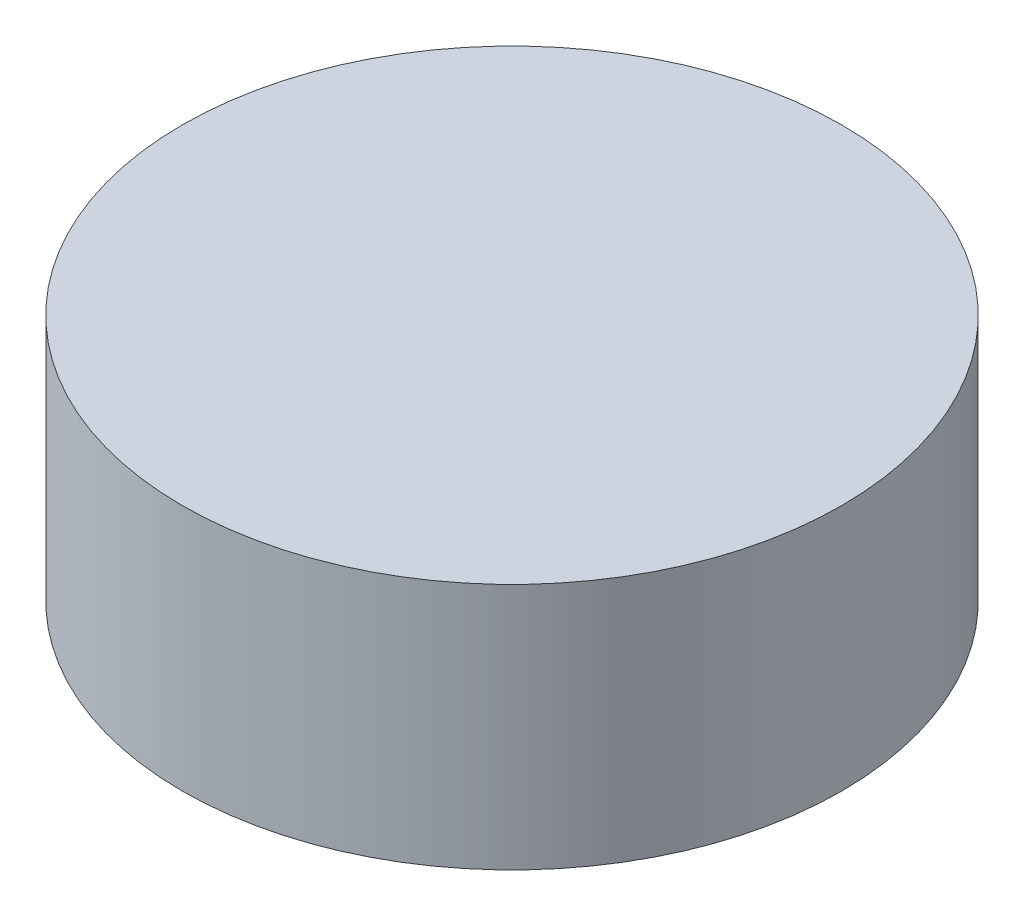
from build123d import *

# Parameters (mm, degrees)
SKETCH1_R           = 0.4
BOSS_EXTRUDE1_DEPTH = 0.3


with BuildPart() as part:
    # Sketch1 → Boss-Extrude1 (new body)
    with BuildSketch(Plane(origin=(0, 0, 0), x_dir=(1, 0, 0), z_dir=(0, 1, 0))):
        with Locations(Location((0, 0, 0), (0, 0, 270))):
            Circle(SKETCH1_R)
    extrude(amount=BOSS_EXTRUDE1_DEPTH)


solid = part.part
